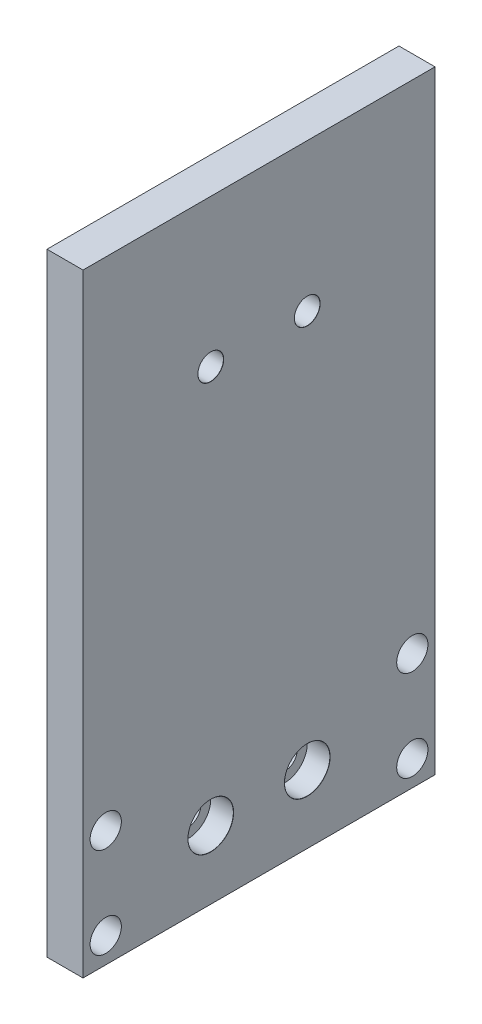
from build123d import *

# Parameters (mm, degrees)
SKETCH1_W                      = 62
SKETCH1_H                      = 108
BOSS_EXTRUDE1_DEPTH            = 6.35
M5_CLEARANCE_HOLE1_D           = 5.5
M5_CLEARANCE_HOLE1_CSINK_D     = 5.55
M5_CLEARANCE_HOLE1_CSINK_ANGLE = 100
M4_CLEARANCE_HOLE1_D           = 4.5
M4_CLEARANCE_HOLE1_CSINK_D     = 4.55
M4_CLEARANCE_HOLE1_CSINK_ANGLE = 100
CBORE_FOR_M4_SHCS1_AT_2_COUNT  = 2
CBORE_FOR_M4_SHCS1_AT_2_PITCH  = 17


with BuildPart() as part:
    # Sketch1 → Boss-Extrude1 (new body)
    with BuildSketch(Plane(origin=(0, 0, 0), x_dir=(0, 0, -1), z_dir=(1, 0, 0))):
        with Locations((31, 54)):
            Rectangle(SKETCH1_W, SKETCH1_H)
    extrude(amount=BOSS_EXTRUDE1_DEPTH)

    # M5 Clearance Hole1 (through all)
    with Locations(Plane.ZY):
        with Locations((-4, 20.5), (-4, 4.5), (-58, 4.5), (-58, 20.5)):
            CounterSinkHole(M5_CLEARANCE_HOLE1_D / 2, M5_CLEARANCE_HOLE1_CSINK_D / 2, counter_sink_angle=M5_CLEARANCE_HOLE1_CSINK_ANGLE)

    # M4 Clearance Hole1 (through all)
    with Locations(Plane(origin=(6.35, 0, 0), x_dir=(0, 0, -1), z_dir=(1, 0, 0))):
        with Locations((39.5, 82), (22.5, 82)):
            CounterSinkHole(M4_CLEARANCE_HOLE1_D / 2, M4_CLEARANCE_HOLE1_CSINK_D / 2, counter_sink_angle=M4_CLEARANCE_HOLE1_CSINK_ANGLE)

    # Sketch7 → CBORE for M4 SHCS1 (revolve, cut)
    with BuildSketch(Plane(origin=(6.35, 12, -22.5), x_dir=(0, 0, -1), z_dir=(0, 1, 0))):
        Polygon((0, 0), (0, 6.35), (2.25, 6.35), (2.25, 4), (4, 4), (4, 0.020977491), (4.025, 0), align=None)
    cbore_for_m4_shcs1 = revolve(axis=Axis((12.7, 12, -22.5), (-1, 0, 0)), mode=Mode.SUBTRACT)

    # CBORE for M4 SHCS1 at 2: CBORE for M4 SHCS1 ×2
    with Locations(*[(0, 0, -i * CBORE_FOR_M4_SHCS1_AT_2_PITCH) for i in range(1, CBORE_FOR_M4_SHCS1_AT_2_COUNT)]):
        add(cbore_for_m4_shcs1, mode=Mode.SUBTRACT)


solid = part.part
